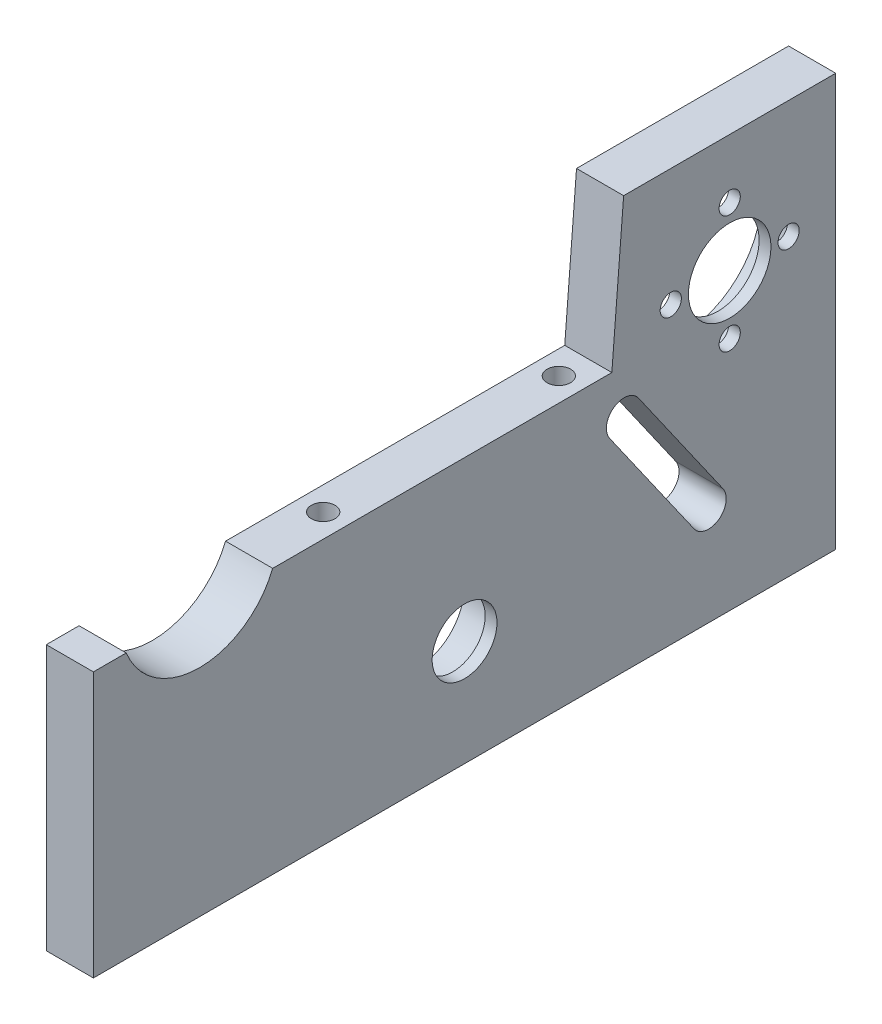
from build123d import *

# Parameters (mm, degrees)
ESQUISSE2_W             = 8
ESQUISSE2_H             = 95
ESQUISSE2_H_2           = 31
BOSS_EXTRU_1_DEPTH      = 70
ESQUISSE3_R             = 7.95
ENL_V_MAT_EXTRU_1_DEPTH = 10
ESQUISSE4_R             = 13.4
ENL_V_MAT_EXTRU_2_DEPTH = 6
ESQUISSE6_R             = 1.8
ESQUISSE6_R_2           = 7
ENL_V_MAT_EXTRU_3_DEPTH = 10
ESQUISSE7_R             = 2
ENL_V_MAT_EXTRU_4_DEPTH = 15
ENL_V_MAT_EXTRU_5_DEPTH = 10
ESQUISSE9_R             = 13.4
ENL_V_MAT_EXTRU_6_DEPTH = 10
ESQUISSE10_R            = 13.4
ENL_V_MAT_EXTRU_7_DEPTH = 10
ESQUISSE12_R            = 8.1
ESQUISSE12_R_2          = 5.5
BOSS_EXTRU_3_DEPTH      = 2
ESQUISSE13_R            = 2
ENL_V_MAT_EXTRU_8_DEPTH = 15


with BuildPart() as part:
    # Esquisse2 → Boss.-Extru.1 (new body)
    with BuildSketch(Plane(origin=(0, 0, 0), x_dir=(1, 0, 0), z_dir=(0, 1, 0))):
        with Locations((4, 47.5)):
            Rectangle(ESQUISSE2_W, ESQUISSE2_H)
        with Locations((4, -15.5)):
            Rectangle(ESQUISSE2_W, ESQUISSE2_H_2)
    extrude(amount=BOSS_EXTRU_1_DEPTH)

    # Esquisse3 → Enlèv. mat.-Extru.1 (cut)
    with BuildSketch(Plane.ZY):
        with Locations((-32, 18)):
            Circle(ESQUISSE3_R)
    extrude(amount=-ENL_V_MAT_EXTRU_1_DEPTH, mode=Mode.SUBTRACT)

    # Esquisse4 → Enlèv. mat.-Extru.2 (cut)
    with BuildSketch(Plane.ZY):
        with Locations((-77, 50)):
            Circle(ESQUISSE4_R)
    extrude(amount=-ENL_V_MAT_EXTRU_2_DEPTH, mode=Mode.SUBTRACT)

    # Esquisse6 → Enlèv. mat.-Extru.3 (cut)
    with BuildSketch(Plane.ZY):
        with Locations((-77, 60)):
            Circle(ESQUISSE6_R)
        with Locations((-67, 50)):
            Circle(ESQUISSE6_R)
        with Locations((-77, 40)):
            Circle(ESQUISSE6_R)
        with Locations((-87, 50)):
            Circle(ESQUISSE6_R)
        with Locations((-77, 50)):
            Circle(ESQUISSE6_R_2)
    extrude(amount=-ENL_V_MAT_EXTRU_3_DEPTH, mode=Mode.SUBTRACT)

    # Esquisse7 → Enlèv. mat.-Extru.4 (cut)
    with BuildSketch(Plane.XZ):
        with Locations(Location((4, -91, 0), (0, 0, 270))):
            Circle(ESQUISSE7_R)
        with Locations(Location((4, -4, 0), (0, 0, 270))):
            Circle(ESQUISSE7_R)
        with Locations(Location((4, 27, 0), (0, 0, 270))):
            Circle(ESQUISSE7_R)
    extrude(amount=-ENL_V_MAT_EXTRU_4_DEPTH, mode=Mode.SUBTRACT)

    # Esquisse8 → Enlèv. mat.-Extru.5 (cut)
    with BuildSketch(Plane.ZY):
        with BuildLine():
            Line((-61.528438992, 38.971206009), (-75.867849901, 18.492404902))
            ThreePointArc((-75.867849901, 18.492404902), (-75.131123077, 14.31421946), (-70.952937635, 15.050946284))
            Line((-70.952937635, 15.050946284), (-56.613526727, 35.529747391))
            ThreePointArc((-56.613526727, 35.529747391), (-57.35025355, 39.707932833), (-61.528438992, 38.971206009))
        make_face()
    extrude(amount=-ENL_V_MAT_EXTRU_5_DEPTH, mode=Mode.SUBTRACT)

    # Esquisse9 → Enlèv. mat.-Extru.6 (cut)
    with BuildSketch(Plane.ZY):
        with Locations((13, 50)):
            Circle(ESQUISSE9_R)
    extrude(amount=-ENL_V_MAT_EXTRU_6_DEPTH, mode=Mode.SUBTRACT)

    # Esquisse10 → Enlèv. mat.-Extru.7 (cut)
    with BuildSketch(Plane.ZY):
        with Locations((13, 50)):
            Circle(ESQUISSE10_R)
        Polygon((-57, 45), (-59, 70), (31, 70), (31, 45), align=None)
        with BuildLine():
            ThreePointArc((0.567783786, 45), (13, 36.6), (25.432216214, 45))
            Line((25.432216214, 45), (0.567783786, 45))
        make_face()
        with BuildLine():
            Line((0.567783786, 45), (25.432216214, 45))
            ThreePointArc((25.432216214, 45), (26.155829455, 47.453600313), (26.4, 50))
            ThreePointArc((26.4, 50), (10.453600313, 63.155829455), (0.567783786, 45))
        make_face()
    extrude(amount=-ENL_V_MAT_EXTRU_7_DEPTH, mode=Mode.SUBTRACT)

    # Esquisse12 → Boss.-Extru.3 (add)
    with BuildSketch(Plane(origin=(8, 0, 0), x_dir=(0, 0, -1), z_dir=(1, 0, 0))):
        with Locations((32, 18)):
            Circle(ESQUISSE12_R)
        with Locations((32, 18)):
            Circle(ESQUISSE12_R_2, mode=Mode.SUBTRACT)
    extrude(amount=-BOSS_EXTRU_3_DEPTH)

    # Esquisse13 → Enlèv. mat.-Extru.8 (cut)
    with BuildSketch(Plane(origin=(0, 45, 0), x_dir=(1, 0, 0), z_dir=(0, 1, 0))):
        with Locations(Location((4, 12, 0), (0, 0, 270))):
            Circle(ESQUISSE13_R)
        with Locations(Location((4, 52, 0), (0, 0, 270))):
            Circle(ESQUISSE13_R)
    extrude(amount=-ENL_V_MAT_EXTRU_8_DEPTH, mode=Mode.SUBTRACT)


solid = part.part
